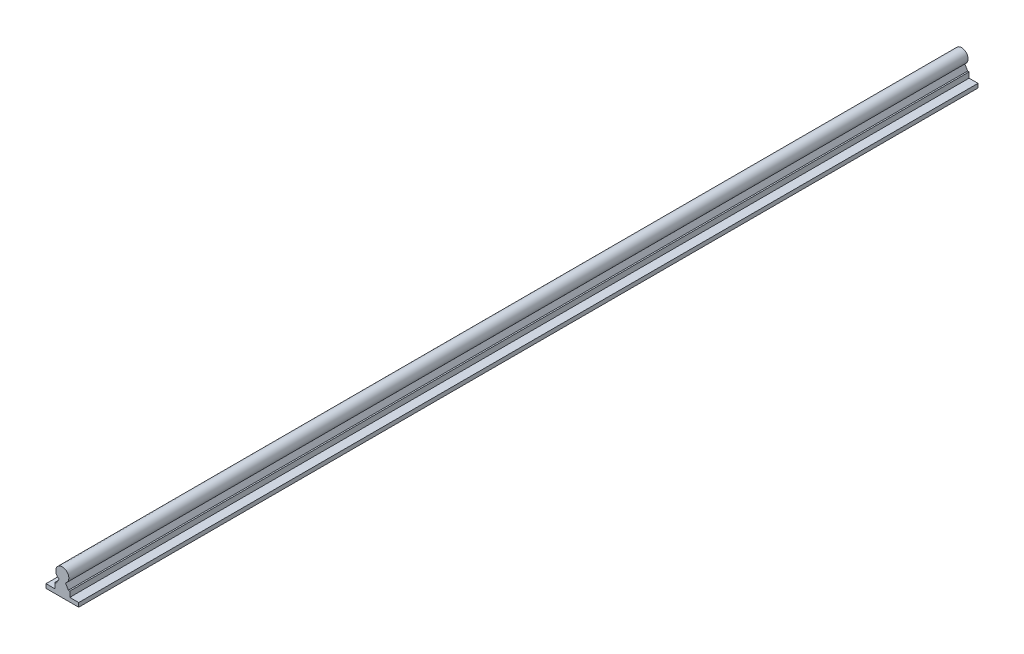
from build123d import *

# Parameters (mm, degrees)
BOSS_EXTRU_1_DEPTH = 1100


with BuildPart() as part:
    # Esquisse1 → Boss.-Extru.1 (new body)
    with BuildSketch(Plane.XY):
        with BuildLine():
            Line((-25.931265673, -2.76101993), (-15.181265673, -2.76101993))
            Line((-15.181265673, -2.76101993), (-15.181265673, 3.93898007))
            Line((-15.181265673, 3.93898007), (-13.453102315, 3.93898007))
            Line((-13.453102315, 3.93898007), (-9.931265673, 10.03898007))
            ThreePointArc((-9.931265673, 10.03898007), (-6.010431334, 25.012290482), (-2.089596996, 10.03898007))
            Line((-2.089596996, 10.03898007), (1.432239646, 3.93898007))
            Line((1.432239646, 3.93898007), (3.160403004, 3.93898007))
            Line((3.160403004, 3.93898007), (3.160403004, -2.76101993))
            Line((3.160403004, -2.76101993), (14.068734327, -2.76101993))
            Line((14.068734327, -2.76101993), (14.068734327, -7.76101993))
            Line((14.068734327, -7.76101993), (-25.931265673, -7.76101993))
            Line((-25.931265673, -7.76101993), (-25.931265673, -2.76101993))
        make_face()
    extrude(amount=BOSS_EXTRU_1_DEPTH)


solid = part.part
